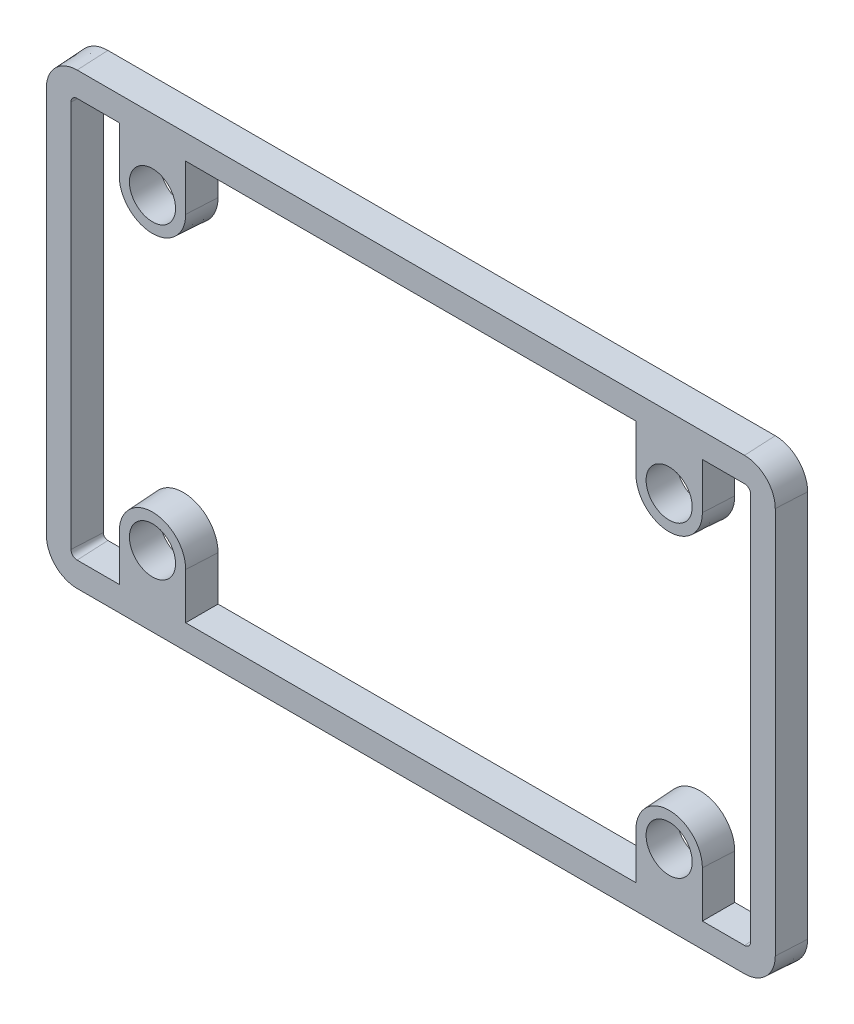
from build123d import *

# Parameters (mm, degrees)
EXTRUDE_5_DEPTH     = 5
EXTRUDE_5_DRAFT     = 3
SKETCH_1_9_R        = 3.75
CUT_EXTRUDE_1_DEPTH = 71.129382412


with BuildPart() as part:
    # ｽｹｯﾁ1 → ﾎﾞｽ - 押し出し5 (with draft: the straight prism first)
    with BuildSketch(Plane.XY):
        with BuildLine():
            ThreePointArc((-59.25, -31.5), (-57.785533906, -35.035533906), (-54.25, -36.5))
            Line((-54.25, -36.5), (54.25, -36.5))
            ThreePointArc((54.25, -36.5), (57.785533906, -35.035533906), (59.25, -31.5))
            Line((59.25, -31.5), (59.25, 31.5))
            ThreePointArc((59.25, 31.5), (57.785533906, 35.035533906), (54.25, 36.5))
            Line((54.25, 36.5), (-54.25, 36.5))
            ThreePointArc((-54.25, 36.5), (-57.785533906, 35.035533906), (-59.25, 31.5))
            Line((-59.25, 31.5), (-59.25, -31.5))
        make_face()
        with BuildLine():
            Line((-54.25, 32.5), (-47.4, 32.5))
            Line((-47.4, 32.5), (-47.4, 25))
            ThreePointArc((-47.4, 25), (-42, 19.6), (-36.6, 25))
            Line((-36.6, 25), (-36.6, 32.5))
            Line((-36.6, 32.5), (36.6, 32.5))
            Line((36.6, 32.5), (36.6, 25))
            ThreePointArc((36.6, 25), (42, 19.6), (47.4, 25))
            Line((47.4, 25), (47.4, 32.5))
            Line((47.4, 32.5), (54.25, 32.5))
            ThreePointArc((54.25, 32.5), (54.957106781, 32.207106781), (55.25, 31.5))
            Line((55.25, 31.5), (55.25, -31.5))
            ThreePointArc((55.25, -31.5), (54.957106781, -32.207106781), (54.25, -32.5))
            Line((54.25, -32.5), (47.4, -32.5))
            Line((47.4, -32.5), (47.4, -25))
            ThreePointArc((47.4, -25), (42, -19.6), (36.6, -25))
            Line((36.6, -25), (36.6, -32.5))
            Line((36.6, -32.5), (-36.6, -32.5))
            Line((-36.6, -32.5), (-36.6, -25))
            ThreePointArc((-36.6, -25), (-42, -19.6), (-47.4, -25))
            Line((-47.4, -25), (-47.4, -32.5))
            Line((-47.4, -32.5), (-54.25, -32.5))
            ThreePointArc((-54.25, -32.5), (-54.957106781, -32.207106781), (-55.25, -31.5))
            Line((-55.25, -31.5), (-55.25, 31.5))
            ThreePointArc((-55.25, 31.5), (-54.957106781, 32.207106781), (-54.25, 32.5))
        make_face(mode=Mode.SUBTRACT)
    extrude(amount=-EXTRUDE_5_DEPTH)
    # ﾎﾞｽ - 押し出し5: the draft: its side faces are tilted about the plane it starts from
    extrude_5_sides = [part.faces().sort_by_distance(p)[0] for p in [
        (-57.785533906, -35.035533906, -2.5),
        (0, -36.5, -2.5),
        (57.785533906, -35.035533906, -2.5),
        (59.25, 0, -2.5),
        (57.785533906, 35.035533906, -2.5),
        (0, 36.5, -2.5),
        (-57.785533906, 35.035533906, -2.5),
        (-59.25, 0, -2.5),
        (-50.825, 32.5, -2.5),
        (-47.4, 28.75, -2.5),
        (-42, 19.6, -2.5),
        (-36.6, 28.75, -2.5),
        (0, 32.5, -2.5),
        (36.6, 28.75, -2.5),
        (42, 19.6, -2.5),
        (47.4, 28.75, -2.5),
        (50.825, 32.5, -2.5),
        (54.957106781, 32.207106781, -2.5),
        (55.25, 0, -2.5),
        (54.957106781, -32.207106781, -2.5),
        (50.825, -32.5, -2.5),
        (47.4, -28.75, -2.5),
        (42, -19.6, -2.5),
        (36.6, -28.75, -2.5),
        (0, -32.5, -2.5),
        (-36.6, -28.75, -2.5),
        (-42, -19.6, -2.5),
        (-47.4, -28.75, -2.5),
        (-50.825, -32.5, -2.5),
        (-54.957106781, -32.207106781, -2.5),
        (-55.25, 0, -2.5),
        (-54.957106781, 32.207106781, -2.5),
    ]]
    draft(extrude_5_sides, Plane.XY, EXTRUDE_5_DRAFT)

    # ｽｹｯﾁ1<9> → ｶｯﾄ - 押し出し1 (cut, through all)
    with BuildSketch(Plane.XY):
        with Locations((-42, 25)):
            Circle(SKETCH_1_9_R)
        with Locations((-42, -25)):
            Circle(SKETCH_1_9_R)
        with Locations((42, -25)):
            Circle(SKETCH_1_9_R)
        with Locations((42, 25)):
            Circle(SKETCH_1_9_R)
    extrude(amount=-CUT_EXTRUDE_1_DEPTH, mode=Mode.SUBTRACT)


solid = part.part
